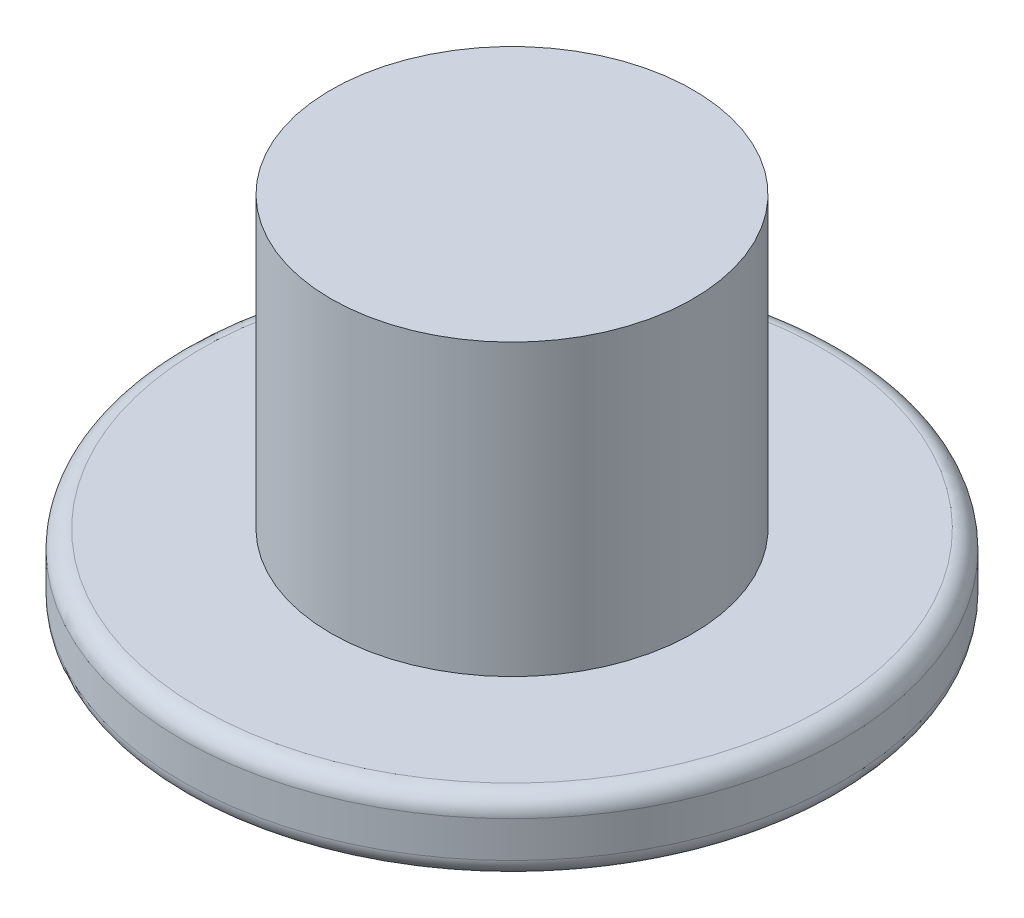
from build123d import *

# Parameters (mm, degrees)
SKETCH1_R           = 9.1
BOSS_EXTRUDE5_DEPTH = 2
SKETCH4_R           = 5
BOSS_EXTRUDE6_DEPTH = 8
CUT_EXTRUDE2_DEPTH  = 0.5
FILLET1_R           = 0.5


with BuildPart() as part:
    # Sketch1 → Boss-Extrude5 (new body)
    with BuildSketch(Plane(origin=(0, 0, 0), x_dir=(1, 0, 0), z_dir=(0, 1, 0))):
        with Locations(Location((-5.408676197, -40.3067379, 0), (0, 0, 270))):
            Circle(SKETCH1_R)
    extrude(amount=BOSS_EXTRUDE5_DEPTH)

    # Sketch4 → Boss-Extrude6 (add)
    with BuildSketch(Plane(origin=(0, 2, 0), x_dir=(1, 0, 0), z_dir=(0, 1, 0))):
        with Locations(Location((-5.408676197, -40.3067379, 0), (0, 0, 270))):
            Circle(SKETCH4_R)
    extrude(amount=BOSS_EXTRUDE6_DEPTH)

    # Sketch5 → Cut-Extrude2 (cut)
    with BuildSketch(Plane.XZ):
        Polygon((-6.443159021, 44.805369713), (-4.485226328, 44.805369713), (-4.485226328, 35.805369713), (-5.639072482, 35.805369713), (-5.639072482, 43.766908174), (-7.023687867, 43.766908174), align=None)
    extrude(amount=-CUT_EXTRUDE2_DEPTH, mode=Mode.SUBTRACT)

    # Fillet1
    fillet1_edges = [part.edges().sort_by_distance(p)[0] for p in [
        (-5.408676197, 0, 31.2067379),
        (-5.408676197, 2, 31.2067379),
    ]]
    fillet(fillet1_edges, radius=FILLET1_R)


solid = part.part
